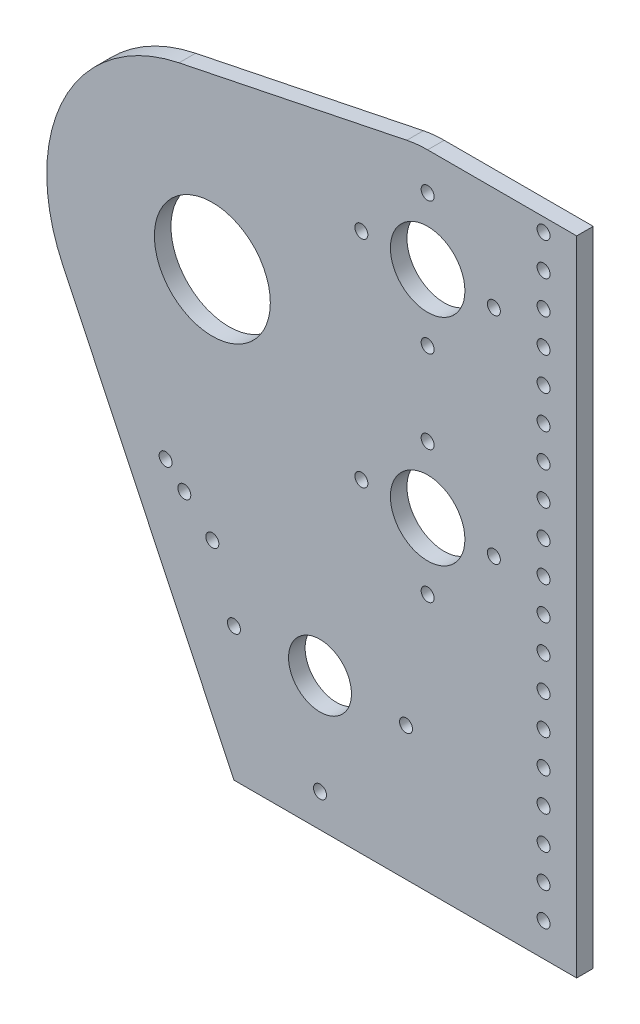
from build123d import *

# Parameters (mm, degrees)
SKETCH1_R                  = 22.225
SKETCH1_R_2                = 14.2875
SKETCH1_R_3                = 12.065
BOSS_EXTRUDE1_DEPTH        = 6.35
F_9_0_196_DIAMETER_HOLE1_D = 4.9784


with BuildPart() as part:
    # Sketch1 → Boss-Extrude1 (new body)
    with BuildSketch(Plane(origin=(0, 0, 0), x_dir=(0, 1, 0), z_dir=(0, 0, 1))):
        with BuildLine():
            Line((80.9625, -82.55), (80.9625, -139.7))
            Line((80.9625, -139.7), (-165.481, -139.7))
            Line((-165.481, -139.7), (-165.481, -8.2804))
            Line((-165.481, -8.2804), (-27.237142114, 57.361904514))
            ThreePointArc((-27.237142114, 57.361904514), (28.32715108, 56.831527444), (62.200093141, 12.782738878))
            Line((62.200093141, 12.782738878), (80.150058213, -74.560788201))
            ThreePointArc((80.150058213, -74.560788201), (80.758867143, -78.534792445), (80.9625, -82.55))
        make_face()
        with Locations(Location((0, 0, 0), (0, 0, 270))):
            Circle(SKETCH1_R, mode=Mode.SUBTRACT)
        with Locations(Location((-41.275, -82.55, 0), (0, 0, 270))):
            Circle(SKETCH1_R_2, mode=Mode.SUBTRACT)
        with Locations(Location((41.275, -82.55, 0), (0, 0, 270))):
            Circle(SKETCH1_R_2, mode=Mode.SUBTRACT)
        with Locations(Location((-114.3, -41.275, 0), (0, 0, 270))):
            Circle(SKETCH1_R_3, mode=Mode.SUBTRACT)
    extrude(amount=BOSS_EXTRUDE1_DEPTH)

    # #9 (0.196) Diameter Hole1 (through all)
    with Locations(Plane.XY.offset(6.35)):
        with Locations((127, 75.819), (82.55, -41.275), (82.55, 41.275), (57.15, 41.275), (82.55, 66.675), (107.95, 41.275), (82.55, 15.875), (82.55, -15.875), (57.15, -41.275), (82.55, -66.675), (107.95, -41.275), (127, -152.781), (127, -140.081), (127, -127.381), (127, -114.681), (127, -101.981), (127, -89.281), (127, -76.581), (127, -63.881), (127, -51.181), (127, -38.481), (127, -25.781), (127, -13.081), (-17.927602772, -71.974049098), (-10.756561663, -79.171393707), (0, -89.96741062), (41.275, -112.8014), (74.2696, -114.3), (41.275, -152.781), (8.2804, -114.3), (127, -0.381), (127, 12.319), (127, 25.019), (127, 37.719), (127, 50.419), (127, 63.119)):
            Hole(F_9_0_196_DIAMETER_HOLE1_D / 2)


solid = part.part
